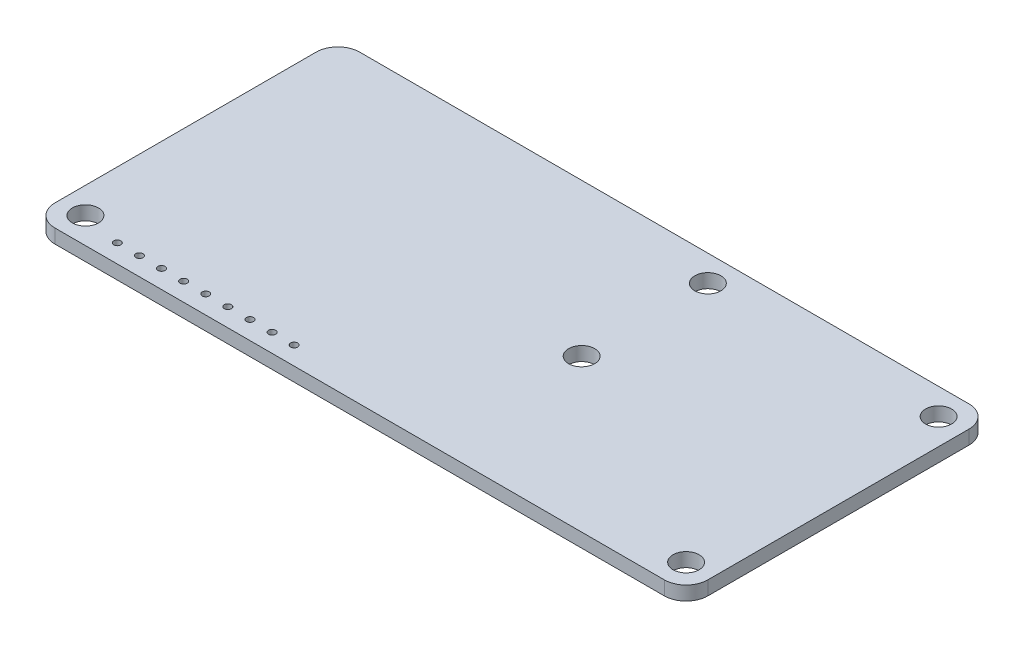
from build123d import *

# Parameters (mm, degrees)
BOSS_EXTRUDE1_DEPTH = 1.6
SKETCH2_R           = 1.5
SKETCH2_R_2         = 0.406594982
CUT_EXTRUDE1_DEPTH  = 42.413282893


with BuildPart() as part:
    # Sketch1 → Boss-Extrude1 (new body)
    with BuildSketch(Plane(origin=(0, 0, 0), x_dir=(1, 0, 0), z_dir=(0, 1, 0))):
        with BuildLine():
            Line((-35, 17.5), (35, 17.5))
            ThreePointArc((35, 17.5), (36.767766953, 16.767766953), (37.5, 15))
            Line((37.5, 15), (37.5, -15))
            ThreePointArc((37.5, -15), (36.767766953, -16.767766953), (35, -17.5))
            Line((35, -17.5), (-35, -17.5))
            ThreePointArc((-35, -17.5), (-36.767766953, -16.767766953), (-37.5, -15))
            Line((-37.5, -15), (-37.5, 15))
            ThreePointArc((-37.5, 15), (-36.767766953, 16.767766953), (-35, 17.5))
        make_face()
    extrude(amount=BOSS_EXTRUDE1_DEPTH)

    # Sketch2 → Cut-Extrude1 (cut, through all)
    with BuildSketch(Plane(origin=(0, 1.6, 0), x_dir=(1, 0, 0), z_dir=(0, 1, 0))):
        with Locations(Location((-34.5, -14.5, 0), (0, 0, 270))):
            Circle(SKETCH2_R)
        with Locations(Location((34.5, -14.5, 0), (0, 0, 270))):
            Circle(SKETCH2_R)
        with Locations(Location((34.5, 14.5, 0), (0, 0, 270))):
            Circle(SKETCH2_R)
        with Locations(Location((8, 0, 0), (0, 0, 270))):
            Circle(SKETCH2_R)
        with Locations(Location((8, 14.5, 0), (0, 0, 270))):
            Circle(SKETCH2_R)
        with Locations(Location((-29.94018139, -15.399310559, 0), (0, 0, 270))):
            Circle(SKETCH2_R_2)
        with Locations(Location((-27.40018139, -15.399310559, 0), (0, 0, 270))):
            Circle(SKETCH2_R_2)
        with Locations(Location((-24.86018139, -15.399310559, 0), (0, 0, 270))):
            Circle(SKETCH2_R_2)
        with Locations(Location((-22.32018139, -15.399310559, 0), (0, 0, 270))):
            Circle(SKETCH2_R_2)
        with Locations(Location((-19.78018139, -15.399310559, 0), (0, 0, 270))):
            Circle(SKETCH2_R_2)
        with Locations(Location((-17.24018139, -15.399310559, 0), (0, 0, 270))):
            Circle(SKETCH2_R_2)
        with Locations(Location((-14.70018139, -15.399310559, 0), (0, 0, 270))):
            Circle(SKETCH2_R_2)
        with Locations(Location((-12.16018139, -15.399310559, 0), (0, 0, 270))):
            Circle(SKETCH2_R_2)
        with Locations(Location((-9.62018139, -15.399310559, 0), (0, 0, 270))):
            Circle(SKETCH2_R_2)
    extrude(amount=-CUT_EXTRUDE1_DEPTH, mode=Mode.SUBTRACT)


solid = part.part
